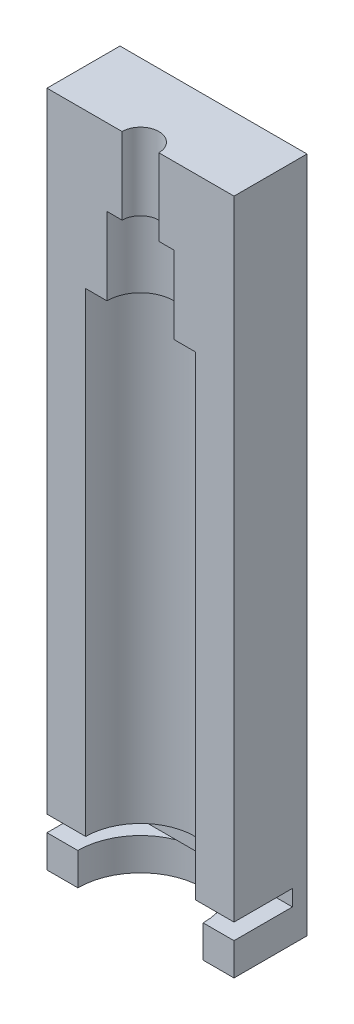
from build123d import *

# Parameters (mm, degrees)
SKETCH1_W               = 150
SKETCH1_H               = 300
BOSS_EXTRUDE1_DEPTH     = 10
FLANGE_SLIT_W           = 26
FLANGE_SLIT_H           = 2.2
FLANGE_SLOT_DEPTH       = 8
SKETCH3_W               = 7.5
SKETCH3_H               = 65
SKETCH6_W               = 57.250839866
SKETCH6_H               = 300
CUT_EXTRUDE2_DEPTH      = 169.002976164
SKETCH7_W               = 8.586676089
SKETCH7_H               = 4.428918394
CUT_EXTRUDE3_DEPTH      = 169.002976164
CUT_EXTRUDE3_DEPTH_BACK = 169.002976164
SKETCH15_W              = 274.383047756
SKETCH15_H              = 92.749160134


with BuildPart() as part:
    # Sketch1 → Boss-Extrude1 (new body)
    with BuildSketch(Plane(origin=(0, 0, 0), x_dir=(0, 1, 0), z_dir=(0, 0, 1))):
        Rectangle(SKETCH1_W, SKETCH1_H)
    extrude(amount=BOSS_EXTRUDE1_DEPTH)

    # flange slit → Flange Slot (cut)
    with BuildSketch(Plane.XY.offset(10)):
        with Locations((-137.383047756, -69.471081606)):
            Rectangle(FLANGE_SLIT_W, FLANGE_SLIT_H)
    extrude(amount=-FLANGE_SLOT_DEPTH, mode=Mode.SUBTRACT)

    # Sketch3 → Syringe Body Slot (revolve, cut)
    with BuildSketch(Plane.XY.offset(10)):
        with Locations((-140.941523878, -35.871081606)):
            Rectangle(SKETCH3_W, SKETCH3_H)
    revolve(axis=Axis((-137.191523878, 75, 10), (0, -1, 0)), mode=Mode.SUBTRACT)

    # Sketch6 → Cut-Extrude2 (cut, through all)
    with BuildSketch(Plane(origin=(0, 0, 10), x_dir=(0, -1, 0), z_dir=(0, 0, 1))):
        with Locations((-46.374580067, 0)):
            Rectangle(SKETCH6_W, SKETCH6_H)
    extrude(amount=-CUT_EXTRUDE2_DEPTH, mode=Mode.SUBTRACT)

    # Sketch7 → Plunger Slot (revolve, cut)
    with BuildSketch(Plane.XY.offset(10)):
        with Locations((-141.484861922, -72.785540803)):
            Rectangle(SKETCH7_W, SKETCH7_H)
    revolve(axis=Axis((-137.191523878, -70.571081606, 10), (0, -1, 0)), mode=Mode.SUBTRACT)

    # Sketch8 → Cut-Revolve1 (revolve, cut)
    with BuildSketch(Plane.XY.offset(10)):
        Polygon((-137.191523878, -3.371081606), (-141.791523878, -3.371081606), (-141.791523878, 7.236534378), (-139.709650935, 7.236534378), (-139.709650935, 17.749160134), (-137.191523878, 17.749160134), (-137.191523878, 4.628918394), align=None)
    revolve(axis=Axis((-137.191523878, -3.371081606, 10), (0, 1, 0)), mode=Mode.SUBTRACT)

    # Sketch15 → Cut-Extrude3 (cut, two sides: drawn at the far end of the back side and taken through both)
    with BuildSketch(Plane.XY.offset(10).offset(-CUT_EXTRUDE3_DEPTH_BACK)):
        with Locations((12.808476122, -28.625419933)):
            Rectangle(SKETCH15_W, SKETCH15_H)
    extrude(amount=CUT_EXTRUDE3_DEPTH + CUT_EXTRUDE3_DEPTH_BACK, mode=Mode.SUBTRACT)


solid = part.part
